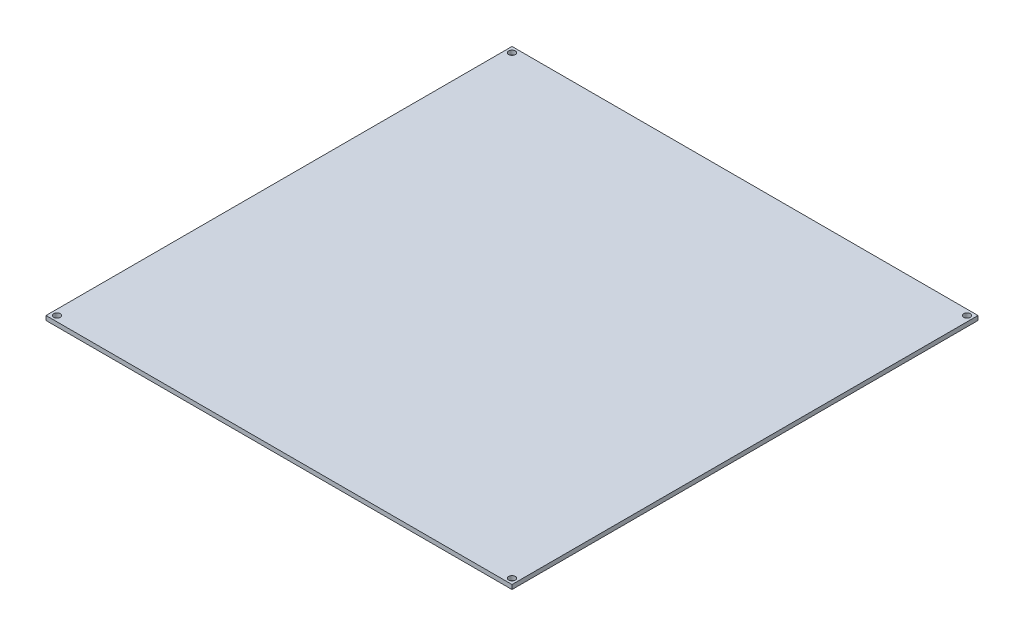
from build123d import *

# Parameters (mm, degrees)
SKETCH1_W           = 214
SKETCH1_H           = 214
SKETCH1_R           = 1.5
BOSS_EXTRUDE1_DEPTH = 2


with BuildPart() as part:
    # Sketch1 → Boss-Extrude1 (new body)
    with BuildSketch(Plane(origin=(0, 0, 0), x_dir=(1, 0, 0), z_dir=(0, 1, 0))):
        Rectangle(SKETCH1_W, SKETCH1_H)
        with Locations(Location((-104.5, 104.5, 0), (0, 0, 270))):
            Circle(SKETCH1_R, mode=Mode.SUBTRACT)
        with Locations(Location((104.5, 104.5, 0), (0, 0, 270))):
            Circle(SKETCH1_R, mode=Mode.SUBTRACT)
        with Locations(Location((104.5, -104.5, 0), (0, 0, 270))):
            Circle(SKETCH1_R, mode=Mode.SUBTRACT)
        with Locations(Location((-104.5, -104.5, 0), (0, 0, 270))):
            Circle(SKETCH1_R, mode=Mode.SUBTRACT)
    extrude(amount=BOSS_EXTRUDE1_DEPTH)


solid = part.part
